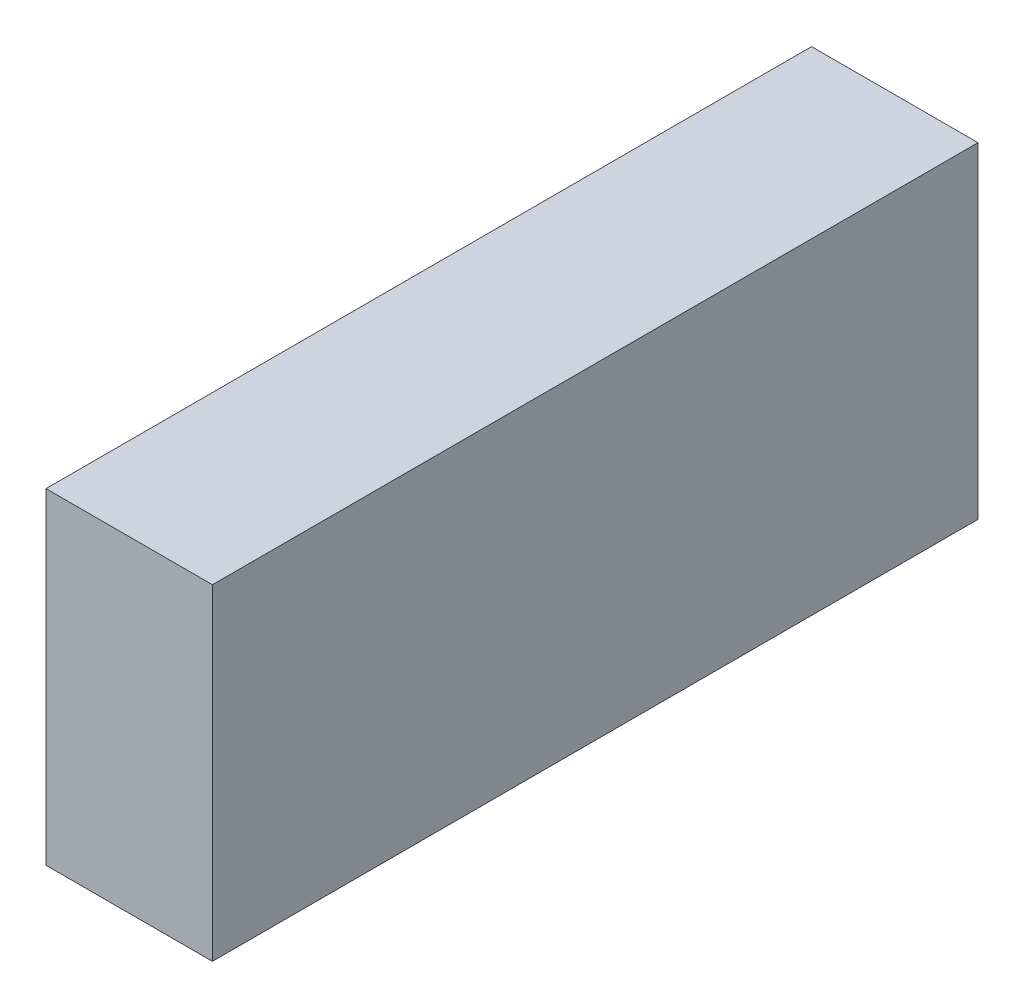
from build123d import *

# Parameters (mm, degrees)
ESBO_O1_W                = 50
ESBO_O1_H                = 98
RESSALTO_EXTRUS_O1_DEPTH = 230


with BuildPart() as part:
    # Esboço1 → Ressalto-extrusão1 (new body)
    with BuildSketch(Plane.XY):
        with Locations((25, 49)):
            Rectangle(ESBO_O1_W, ESBO_O1_H)
    extrude(amount=RESSALTO_EXTRUS_O1_DEPTH)


solid = part.part
